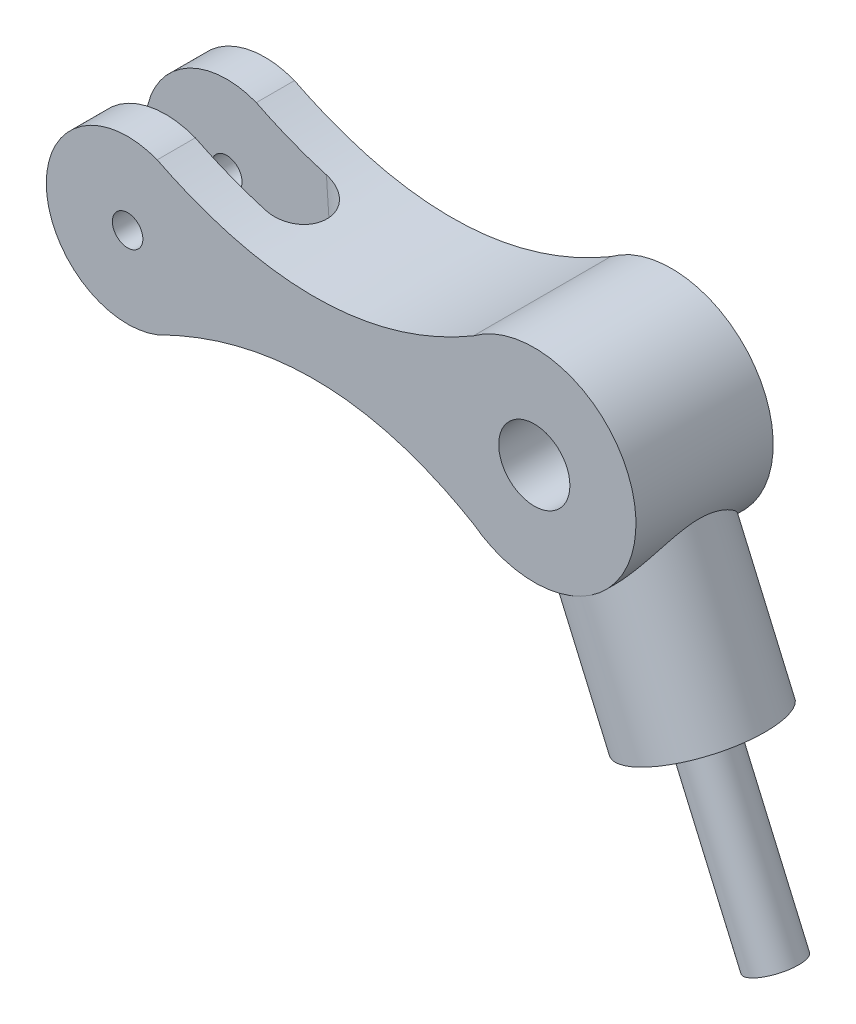
from build123d import *

# Parameters (mm, degrees)
SKETCH1_R                = 3.5
SKETCH1_R_2              = 1.5
BOSS_EXTRUDE2_DEPTH      = 13.5
CUT_EXTRUDE4_DEPTH       = 70.616522229
CUT_EXTRUDE4_DEPTH_BACK  = 70.616522229
BOSS_EXTRUDE3_DEPTH      = 13
BOSS_EXTRUDE3_DEPTH_BACK = 5
SKETCH4_R                = 6.75
SKETCH7_R                = 1.5
SKETCH7_R_2              = 0.7
BOSS_EXTRUDE4_DEPTH      = 10
SKETCH9_R                = 2.5
BOSS_EXTRUDE5_DEPTH      = 18


with BuildPart() as part:
    # Sketch1 → Boss-Extrude2 (new body)
    with BuildSketch(Plane.XY):
        with BuildLine():
            ThreePointArc((49.948019617, -8.004321858), (65.942252812, 0), (49.948019617, 8.004321858))
            add(Edge.make_bspline(
                [(49.948019617, 8.004321858), (35.174968068, -0.699990604), (18.85115398, 7.452401894)],
                knots=[0, 0, 0, 1, 1, 1], degree=2))
            ThreePointArc((18.85115398, 7.452401894), (7.942252812, 0), (18.85115398, -7.452401894))
            add(Edge.make_bspline(
                [(49.948019617, -8.004321858), (35.174968068, 0.699990604), (18.85115398, -7.452401894)],
                knots=[0, 0, 0, 1, 1, 1], degree=2))
        make_face()
        with Locations((55.942252812, 0)):
            Circle(SKETCH1_R, mode=Mode.SUBTRACT)
        with Locations((15.942252812, 0)):
            Circle(SKETCH1_R_2, mode=Mode.SUBTRACT)
    extrude(amount=BOSS_EXTRUDE2_DEPTH)

    # Sketch3 → Cut-Extrude4 (cut, two sides: drawn at the far end of the back side and taken through both)
    with BuildSketch(Plane(origin=(-0.424036019, 6.116012378, 0), x_dir=(0.9976051599790391, 0.06916606670323111, 0), z_dir=(-0.06916606670323111, 0.9976051599790391, 0)).offset(-CUT_EXTRUDE4_DEPTH_BACK)):
        with BuildLine():
            Line((26.011787518, -9.75), (7.904073667, -9.75))
            Line((7.904073667, -9.75), (7.904073667, -3.75))
            Line((7.904073667, -3.75), (26.011787518, -3.75))
            ThreePointArc((26.011787518, -3.75), (29.011787518, -6.75), (26.011787518, -9.75))
        make_face()
    extrude(amount=CUT_EXTRUDE4_DEPTH + CUT_EXTRUDE4_DEPTH_BACK, mode=Mode.SUBTRACT)

    # Sketch4 → Boss-Extrude3 (add, two sides: drawn at the far end of the back side and taken through both)
    with BuildSketch(Plane(origin=(12.882354757, -29.627387579, 0), x_dir=(0, 0, -1), z_dir=(0.39874906892524703, -0.9170600743851237, 0)).offset(-BOSS_EXTRUDE3_DEPTH_BACK)):
        with Locations(Location((-6.75, 51.958012611, 0), (0, 0, 90))):
            Circle(SKETCH4_R)
    extrude(amount=BOSS_EXTRUDE3_DEPTH + BOSS_EXTRUDE3_DEPTH_BACK)

    # Sketch7 → Boss-Extrude4 (add)
    with BuildSketch(Plane(origin=(18.066092653, -41.549168546, 0), x_dir=(0.9170600743851237, 0.39874906892524703, 0), z_dir=(0.39874906892524703, -0.9170600743851237, 0))):
        with Locations((51.958012611, 6.75)):
            Circle(SKETCH7_R)
        with Locations((51.958012611, 6.75)):
            Circle(SKETCH7_R_2, mode=Mode.SUBTRACT)
    extrude(amount=BOSS_EXTRUDE4_DEPTH)

    # Sketch9 → Boss-Extrude5 (add)
    with BuildSketch(Plane(origin=(18.066092653, -41.549168546, 0), x_dir=(0.9170600743851237, 0.39874906892524703, 0), z_dir=(0.39874906892524703, -0.9170600743851237, 0))):
        with Locations(Location((51.958012611, 6.75, 0), (0, 0, 180))):
            Circle(SKETCH9_R)
    extrude(amount=BOSS_EXTRUDE5_DEPTH)


solid = part.part
